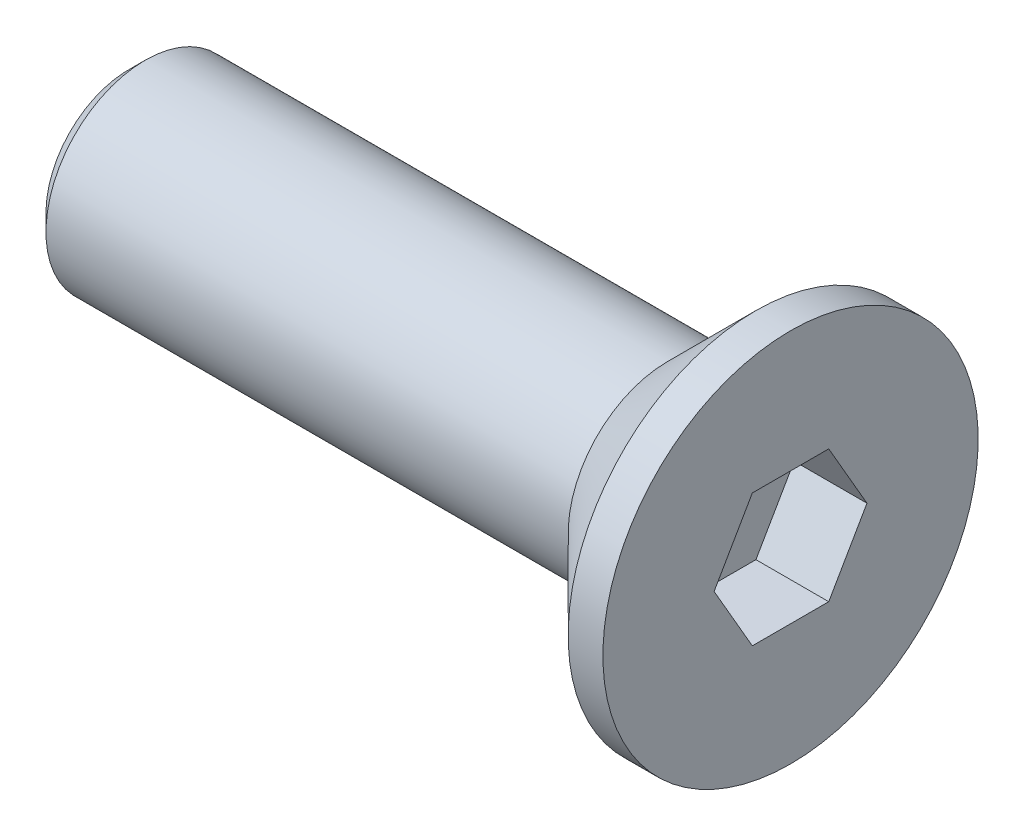
from build123d import *

# Parameters (mm, degrees)
CUT_EXTRUDE1_DEPTH = 2.2
CHAMFER1_SIZE      = 0.5


with BuildPart() as part:
    # Sketch1 → Revolve1 (revolve)
    with BuildSketch(Plane.XY):
        Polygon((0, 0), (0, 5.67), (-1.05, 5.67), (-3.72, 3), (-20, 3), (-20, 0), align=None)
    revolve(axis=Axis((0, 0, 0), (-1, 0, 0)))

    # Sketch2 → Cut-Extrude1 (cut)
    with BuildSketch(Plane(origin=(0, 0, 0), x_dir=(0, 0, -1), z_dir=(1, 0, 0))):
        Polygon((2.309401077, 0), (1.154700538, 2), (-1.154700538, 2), (-2.309401077, 0), (-1.154700538, -2), (1.154700538, -2), align=None)
    extrude(amount=-CUT_EXTRUDE1_DEPTH, mode=Mode.SUBTRACT)

    # Chamfer1
    chamfer1_edges = [part.edges().sort_by_distance(p)[0] for p in [
        (-20, -3, 0),
    ]]
    chamfer(chamfer1_edges, length=CHAMFER1_SIZE)


solid = part.part
